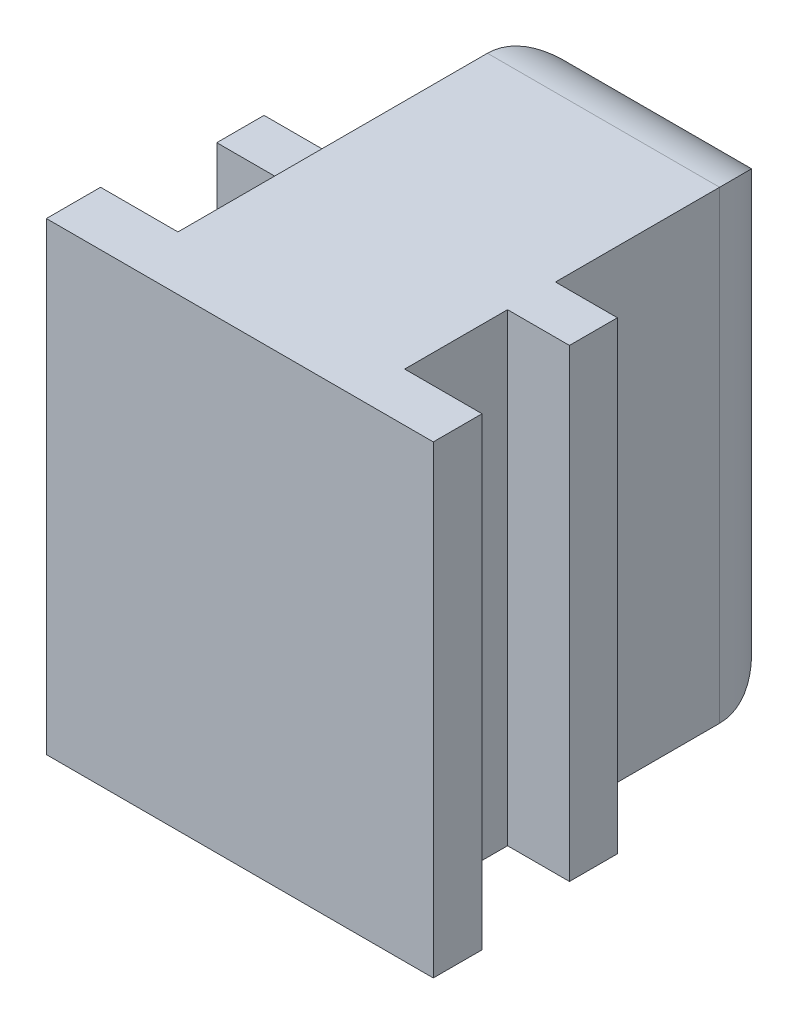
from build123d import *

# Parameters (mm, degrees)
SKETCH_3_W           = 3
SKETCH_3_H           = 6
EXTRUDE_2_DEPTH      = 3.5
SKETCH_4_OUTSIDE_W   = 6.514
SKETCH_4_OUTSIDE_H   = 9.514
SKETCH_4_OUTSIDE_W_2 = 1.417406922
SKETCH_4_OUTSIDE_H_2 = 3.080497711
CUT_EXTRUDE_1_DEPTH  = 0.8
SKETCH_9_W           = 3
SKETCH_9_H           = 6
EXTRUDE_5_DEPTH      = 1.5
FILLET_2_R           = 1
SKETCH_6_W           = 0.611138618
SKETCH_6_H           = 5.948224028
EXTRUDE_3_DEPTH      = 0.8
SKETCH_8_W           = 0.619217593
SKETCH_8_H           = 6
EXTRUDE_4_DEPTH      = 0.8
SKETCH_10_W          = 2.94488386
SKETCH_10_H          = 5.934698602
EXTRUDE_6_DEPTH      = 2
SKETCH_11_W          = 3
SKETCH_11_H          = 6
EXTRUDE_7_DEPTH      = 1.5
SKETCH_12_W          = 0.7
SKETCH_12_H          = 6
EXTRUDE_8_DEPTH      = 1.5
SKETCH_13_W          = 0.6302849
SKETCH_13_H          = 6
EXTRUDE_9_DEPTH      = 1.5
SKETCH_14_W          = 0.6302849
SKETCH_14_H          = 6
CUT_EXTRUDE_2_DEPTH  = 0.5
SKETCH_15_W          = 0.7
SKETCH_15_H          = 6
CUT_EXTRUDE_3_DEPTH  = 0.5
SKETCH_16_W          = 5
SKETCH_16_H          = 0.6302849
EXTRUDE_10_DEPTH     = 1
SKETCH_17_W          = 5
SKETCH_17_H          = 0.7
EXTRUDE_11_DEPTH     = 1
SKETCH_18_W          = 5
SKETCH_18_H          = 0.6302849
CUT_EXTRUDE_4_DEPTH  = 1
SKETCH_19_W          = 5
SKETCH_19_H          = 0.7
CUT_EXTRUDE_5_DEPTH  = 1


with BuildPart() as part:
    # 草图3 → 凸台-拉伸2 (new body)
    with BuildSketch(Plane.XY):
        with Locations((-0.538539978, -1.817017803)):
            Rectangle(SKETCH_3_W, SKETCH_3_H)
    extrude(amount=EXTRUDE_2_DEPTH)

    # 草图4 outside → 切除-拉伸1 (cut)
    with BuildSketch(Plane.XY.offset(3.5)):
        with Locations((-0.539, -1.817)):
            Rectangle(SKETCH_4_OUTSIDE_W, SKETCH_4_OUTSIDE_H)
        with Locations((-0.530790021, -1.736698078)):
            Rectangle(SKETCH_4_OUTSIDE_W_2, SKETCH_4_OUTSIDE_H_2, mode=Mode.SUBTRACT)
    extrude(amount=-CUT_EXTRUDE_1_DEPTH, mode=Mode.SUBTRACT)

    # 草图9 → 凸台-拉伸5 (add)
    with BuildSketch(Plane(origin=(0, 0, 0), x_dir=(-1, 0, 0), z_dir=(0, 0, -1))):
        with Locations((0.538539978, -1.817017803)):
            Rectangle(SKETCH_9_W, SKETCH_9_H)
    extrude(amount=EXTRUDE_5_DEPTH)

    # 圆角2
    fillet_2_edges = [part.edges().sort_by_distance(p)[0] for p in [
        (0.961460022, -1.817017803, -1.5),
        (-0.538539978, -4.817017803, -1.5),
        (-2.038539978, -1.817017803, -1.5),
        (-0.538539978, 1.182982197, -1.5),
    ]]
    fillet(fillet_2_edges, radius=FILLET_2_R)

    # 草图6 → 凸台-拉伸3 (add)
    with BuildSketch(Plane.ZY.offset(2.038539978)):
        with Locations((1.892599011, -1.842905789)):
            Rectangle(SKETCH_6_W, SKETCH_6_H)
    extrude(amount=EXTRUDE_3_DEPTH)

    # 草图8 → 凸台-拉伸4 (add)
    with BuildSketch(Plane(origin=(0.961460022, 0, 0), x_dir=(0, 0, -1), z_dir=(1, 0, 0))):
        with Locations((-1.93059109, -1.817017803)):
            Rectangle(SKETCH_8_W, SKETCH_8_H)
    extrude(amount=EXTRUDE_4_DEPTH)

    # 草图10 → 凸台-拉伸6 (add)
    with BuildSketch(Plane.XY.offset(3.5)):
        with Locations((-0.608169547, -1.884686131)):
            Rectangle(SKETCH_10_W, SKETCH_10_H)
    extrude(amount=-EXTRUDE_6_DEPTH)

    # 草图11 → 凸台-拉伸7 (add)
    with BuildSketch(Plane.XY.offset(2.7)):
        with Locations((-0.538539978, -1.817017803)):
            Rectangle(SKETCH_11_W, SKETCH_11_H)
    extrude(amount=EXTRUDE_7_DEPTH)

    # 草图12 → 凸台-拉伸8 (add)
    with BuildSketch(Plane.ZY.offset(2.038539978)):
        with Locations((3.85, -1.817017803)):
            Rectangle(SKETCH_12_W, SKETCH_12_H)
    extrude(amount=EXTRUDE_8_DEPTH)

    # 草图13 → 凸台-拉伸9 (add)
    with BuildSketch(Plane(origin=(0.961460022, 0, 0), x_dir=(0, 0, -1), z_dir=(1, 0, 0))):
        with Locations((-3.88485755, -1.817017803)):
            Rectangle(SKETCH_13_W, SKETCH_13_H)
    extrude(amount=EXTRUDE_9_DEPTH)

    # 草图14 → 切除-拉伸2 (cut)
    with BuildSketch(Plane(origin=(2.461460022, 0, 0), x_dir=(0, 0, -1), z_dir=(1, 0, 0))):
        with Locations((-3.88485755, -1.817017803)):
            Rectangle(SKETCH_14_W, SKETCH_14_H)
    extrude(amount=-CUT_EXTRUDE_2_DEPTH, mode=Mode.SUBTRACT)

    # 草图15 → 切除-拉伸3 (cut)
    with BuildSketch(Plane.ZY.offset(3.538539978)):
        with Locations((3.85, -1.817017803)):
            Rectangle(SKETCH_15_W, SKETCH_15_H)
    extrude(amount=-CUT_EXTRUDE_3_DEPTH, mode=Mode.SUBTRACT)

    # 草图16 → 凸台-拉伸10 (add)
    with BuildSketch(Plane(origin=(0, 1.182982197, 0), x_dir=(1, 0, 0), z_dir=(0, 1, 0))):
        with Locations((-0.538539978, -3.88485755)):
            Rectangle(SKETCH_16_W, SKETCH_16_H)
    extrude(amount=EXTRUDE_10_DEPTH)

    # 草图17 → 凸台-拉伸11 (add)
    with BuildSketch(Plane.XZ.offset(4.817017803)):
        with Locations((-0.538539978, 3.85)):
            Rectangle(SKETCH_17_W, SKETCH_17_H)
    extrude(amount=EXTRUDE_11_DEPTH)

    # 草图18 → 切除-拉伸4 (cut)
    with BuildSketch(Plane(origin=(0, 2.182982197, 0), x_dir=(1, 0, 0), z_dir=(0, 1, 0))):
        with Locations((-0.538539978, -3.88485755)):
            Rectangle(SKETCH_18_W, SKETCH_18_H)
    extrude(amount=-CUT_EXTRUDE_4_DEPTH, mode=Mode.SUBTRACT)

    # 草图19 → 切除-拉伸5 (cut)
    with BuildSketch(Plane.XZ.offset(5.817017803)):
        with Locations((-0.538539978, 3.85)):
            Rectangle(SKETCH_19_W, SKETCH_19_H)
    extrude(amount=-CUT_EXTRUDE_5_DEPTH, mode=Mode.SUBTRACT)


solid = part.part
